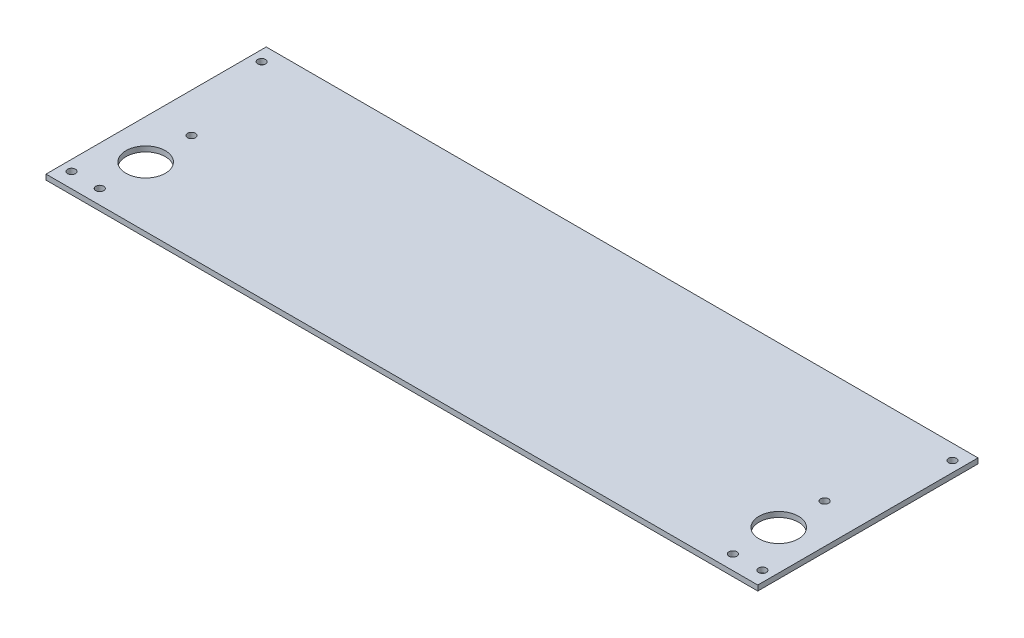
from build123d import *

# Parameters (mm, degrees)
SKETCH1_W           = 271.5
SKETCH1_H           = 84
SKETCH1_R           = 1.5
BOSS_EXTRUDE1_DEPTH = 2
SKETCH2_R           = 1.5
SKETCH2_R_2         = 7.5
CUT_EXTRUDE1_DEPTH  = 10


with BuildPart() as part:
    # Sketch1 → Boss-Extrude1 (new body)
    with BuildSketch(Plane(origin=(0, 0, 0), x_dir=(1, 0, 0), z_dir=(0, 1, 0))):
        with Locations((135.75, 42)):
            Rectangle(SKETCH1_W, SKETCH1_H)
        with Locations(Location((4, 5.75, 0), (0, 0, 270))):
            Circle(SKETCH1_R, mode=Mode.SUBTRACT)
        with Locations(Location((4, 78.25, 0), (0, 0, 270))):
            Circle(SKETCH1_R, mode=Mode.SUBTRACT)
        with Locations(Location((267.5, 5.75, 0), (0, 0, 270))):
            Circle(SKETCH1_R, mode=Mode.SUBTRACT)
        with Locations(Location((267.5, 78.25, 0), (0, 0, 270))):
            Circle(SKETCH1_R, mode=Mode.SUBTRACT)
    extrude(amount=BOSS_EXTRUDE1_DEPTH)

    # Sketch2 → Cut-Extrude1 (cut)
    with BuildSketch(Plane(origin=(0, 2, 0), x_dir=(1, 0, 0), z_dir=(0, 1, 0))):
        with Locations(Location((15, 5.5, 0), (0, 0, 270))):
            Circle(SKETCH2_R)
        with Locations(Location((15, 40.5, 0), (0, 0, 270))):
            Circle(SKETCH2_R)
        with Locations(Location((15, 23, 0), (0, 0, 270))):
            Circle(SKETCH2_R_2)
        with Locations(Location((256.5, 23, 0), (0, 0, 90))):
            Circle(SKETCH2_R_2)
        with Locations(Location((256.5, 40.5, 0), (0, 0, 90))):
            Circle(SKETCH2_R)
        with Locations(Location((256.5, 5.5, 0), (0, 0, 90))):
            Circle(SKETCH2_R)
    extrude(amount=-CUT_EXTRUDE1_DEPTH, mode=Mode.SUBTRACT)


solid = part.part
